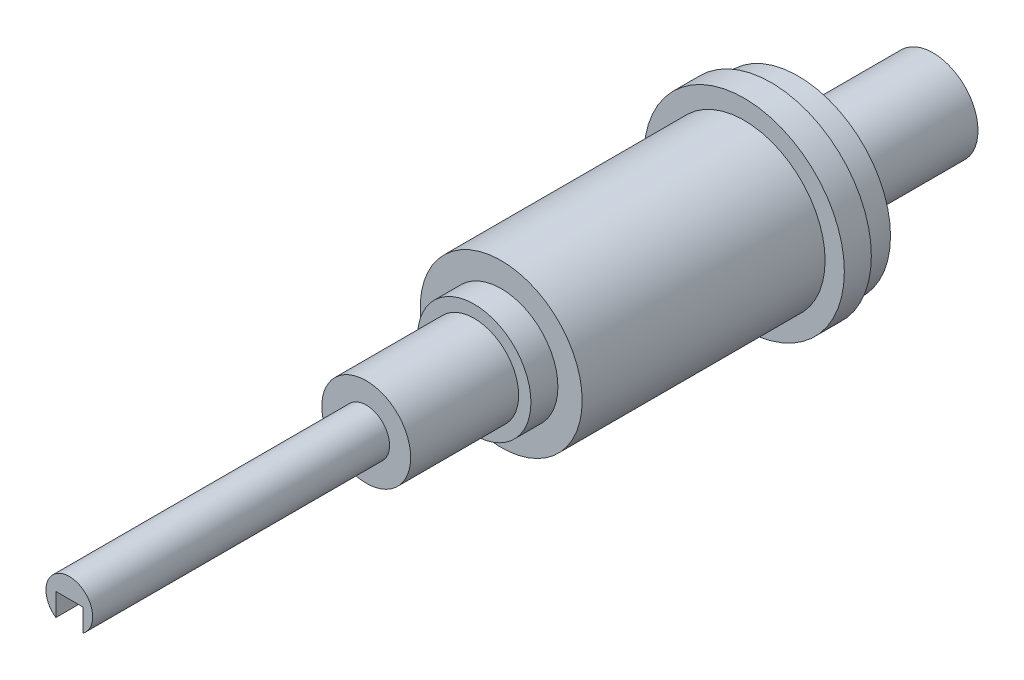
from build123d import *

# Parameters (mm, degrees)
SKETCH2_W          = 6.35
SKETCH2_H          = 50.8
CUT_EXTRUDE1_DEPTH = 6.35
SKETCH3_W          = 6.35
SKETCH3_H          = 38.1
CUT_EXTRUDE2_DEPTH = 6.35


with BuildPart() as part:
    # Sketch1 → Revolve1 (revolve)
    with BuildSketch(Plane(origin=(0, 0, 0), x_dir=(0, 0, -1), z_dir=(1, 0, 0)), mode=Mode.PRIVATE) as revolve1_sk:
        Polygon((0, 0), (0, 5.492242), (69.85, 5.492242), (69.85, 10.4529763), (95.25, 10.4529763), (95.25, 13.340207), (101.6, 13.340207), (101.6, 19.05), (158.75, 19.05), (158.75, 23.579455), (165.1, 23.579455), (165.1, 21.735161), (171.45, 21.735161), (171.45, 10.5689654), (203.2, 10.5689654), (203.2, 0), align=None)
    revolve(revolve1_sk.sketch.rotate(Axis((0, 0, 0), (0, 0, -1)), 90), axis=Axis((0, 0, 0), (0, 0, -1)))

    # Sketch2 → Cut-Extrude1 (cut)
    with BuildSketch(Plane(origin=(0, -5.492242, 0), x_dir=(-1, 0, 0), z_dir=(0, -1, 0))):
        with Locations((0, 25.4)):
            Rectangle(SKETCH2_W, SKETCH2_H)
    extrude(amount=-CUT_EXTRUDE1_DEPTH, mode=Mode.SUBTRACT)

    # Sketch3 → Cut-Extrude2 (cut)
    with BuildSketch(Plane(origin=(0, -19.05, 0), x_dir=(-1, 0, 0), z_dir=(0, -1, 0))):
        with Locations((0, 133.35)):
            Rectangle(SKETCH3_W, SKETCH3_H)
    extrude(amount=-CUT_EXTRUDE2_DEPTH, mode=Mode.SUBTRACT)


solid = part.part
